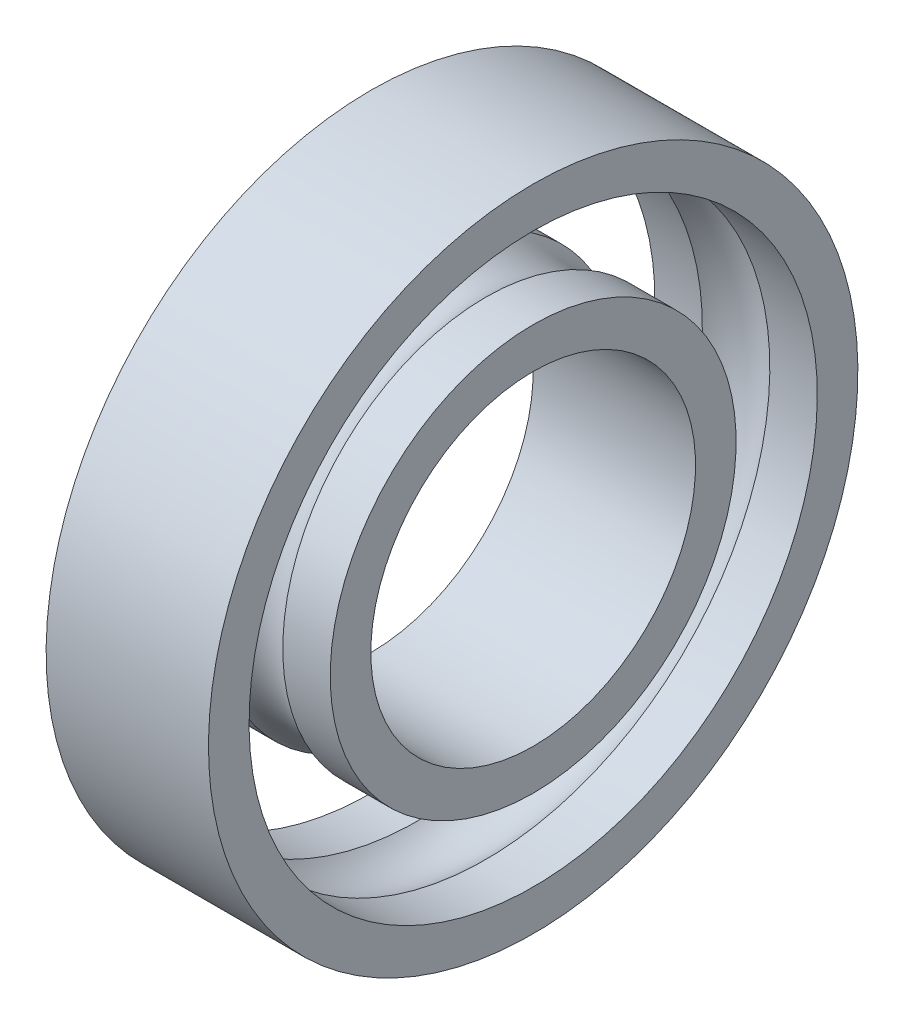
from build123d import *


with BuildPart() as part:
    # Sweep1: sweep along a path in Sketch5
    with BuildLine(Plane(origin=(0, 0, 0), x_dir=(0, 0, -1), z_dir=(1, 0, 0))) as sweep1_path:
        CenterArc((0, 0), 30, 0, 360)
    # Sketch1 → Sweep1 (sweep)
    with BuildSketch(Plane.XY):
        with BuildLine():
            Line((-10, 35), (-4.153311931, 35))
            ThreePointArc((-4.153311931, 35), (0, 36.5), (4.153311931, 35))
            Line((4.153311931, 35), (10, 35))
            Line((10, 35), (10, 40))
            Line((10, 40), (-10, 40))
            Line((-10, 40), (-10, 35))
        make_face()
        with BuildLine():
            Line((-10, 20), (10, 20))
            Line((10, 20), (10, 25))
            Line((10, 25), (4.153311931, 25))
            ThreePointArc((4.153311931, 25), (0, 23.5), (-4.153311931, 25))
            Line((-4.153311931, 25), (-10, 25))
            Line((-10, 25), (-10, 20))
        make_face()
    sweep(path=sweep1_path.line)


solid = part.part
